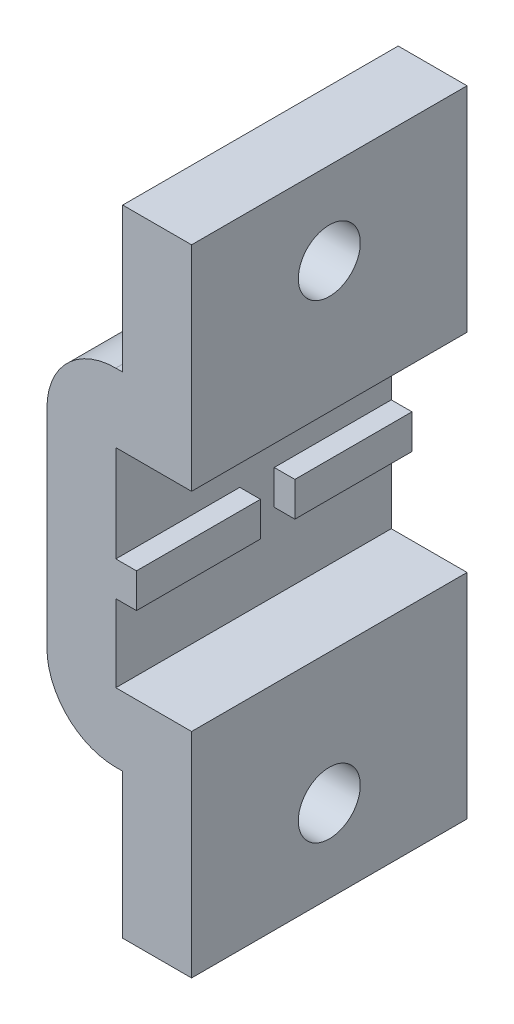
from build123d import *

# Parameters (mm, degrees)
ESTRUSIONE_ESTRUSIONE1_DEPTH = 20
M4_CLEARANCE_HOLE1_D         = 4.5
RACCORDO1_R                  = 5
SCHIZZO4_W                   = 9
SCHIZZO4_H                   = 2.5
SCHIZZO4_W_2                 = 8.5
ESTRUSIONE_ESTRUSIONE2_DEPTH = 1.5


with BuildPart() as part:
    # Schizzo1 → Estrusione-Estrusione1 (new body)
    with BuildSketch(Plane.XY):
        Polygon((0, 30.6), (-5, 30.6), (-5, 20.1), (-10.5, 20.1), (-10.5, -5), (-5, -5), (-5, -15.5), (0, -15.5), (0, 0), (-5.5, 0), (-5.5, 15.1), (0, 15.1), align=None)
    extrude(amount=ESTRUSIONE_ESTRUSIONE1_DEPTH)

    # M4 Clearance Hole1 (through all)
    with Locations(Plane.ZY.offset(5)):
        with Locations((10, 24.6), (10, -9.5)):
            Hole(M4_CLEARANCE_HOLE1_D / 2)

    # Raccordo1
    raccordo1_edges = [part.edges().sort_by_distance(p)[0] for p in [
        (-10.5, -5, 10),
        (-10.5, 20.1, 10),
    ]]
    fillet(raccordo1_edges, radius=RACCORDO1_R)

    # Schizzo4 → Estrusione-Estrusione2 (add)
    with BuildSketch(Plane(origin=(-5.5, 0, 0), x_dir=(0, 0, -1), z_dir=(1, 0, 0))):
        with Locations((-15.5, 6.85)):
            Rectangle(SCHIZZO4_W, SCHIZZO4_H)
        with Locations((-4.25, 6.85)):
            Rectangle(SCHIZZO4_W_2, SCHIZZO4_H)
    extrude(amount=ESTRUSIONE_ESTRUSIONE2_DEPTH)


solid = part.part
